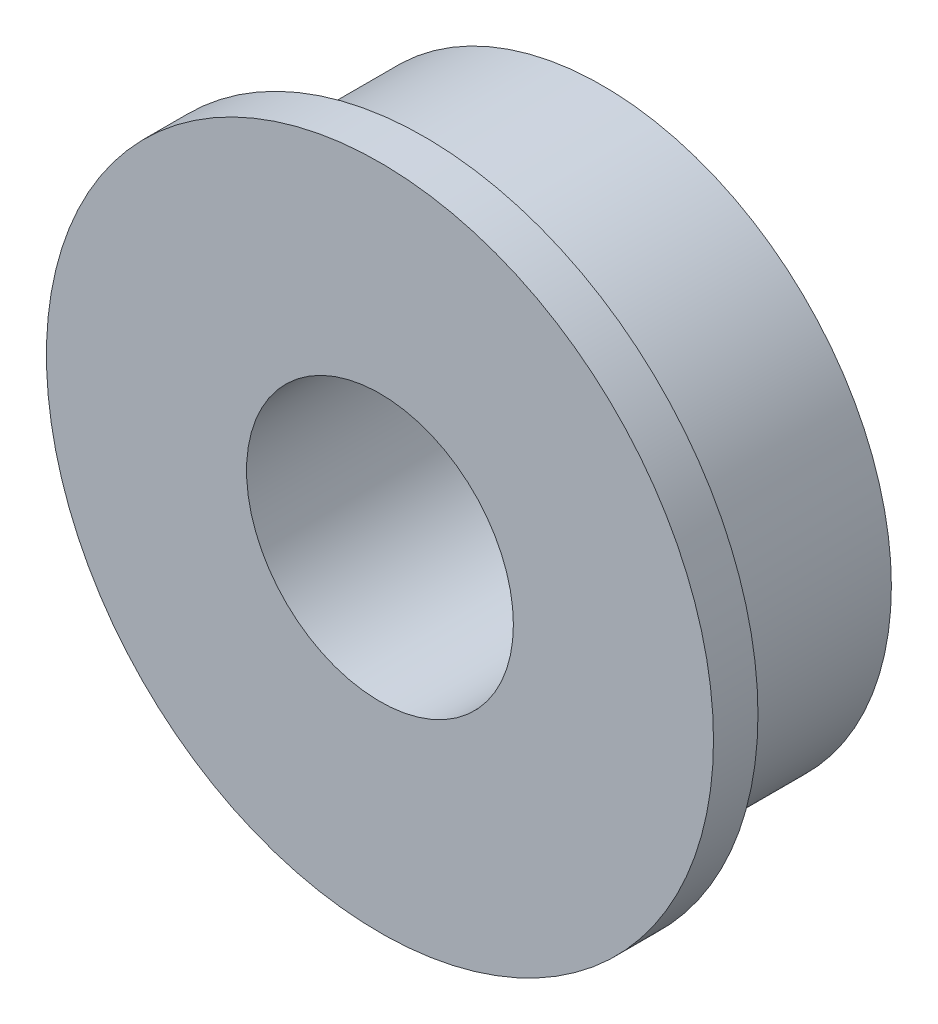
from build123d import *


with BuildPart() as part:
    # Sketch1 → Revolve1 (revolve)
    with BuildSketch(Plane(origin=(0, 0, 0), x_dir=(0, 0, -1), z_dir=(1, 0, 0)), mode=Mode.PRIVATE) as revolve1_sk:
        Polygon((0, 3), (0, 7.5), (1, 7.5), (1, 6.5), (5, 6.5), (5, 3), align=None)
    revolve(revolve1_sk.sketch.rotate(Axis((0, 0, 0), (0, 0, -1)), 90), axis=Axis((0, 0, 0), (0, 0, -1)))


solid = part.part
